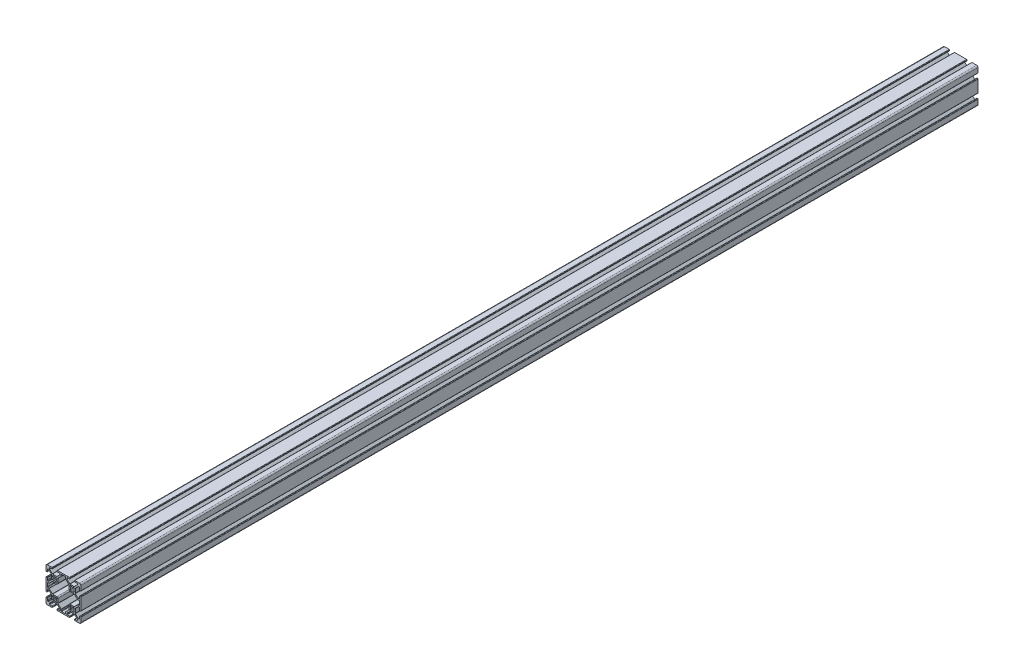
from build123d import *

# Parameters (mm, degrees)
EXTRUDE1_DEPTH = 1031.698


with BuildPart() as part:
    # Sketch1 → Extrude1 (new body)
    with BuildSketch(Plane.XY):
        with BuildLine():
            Line((-36.908207136, -152.779600216), (-32.140368459, -152.779600216))
            ThreePointArc((-32.140368459, -152.779600216), (-31.945965275, -152.818269413), (-31.781158214, -152.928389971))
            Line((-31.781158214, -152.928389971), (-28.678077553, -156.031470632))
            ThreePointArc((-28.678077553, -156.031470632), (-28.567956995, -156.196277694), (-28.529287798, -156.390680877))
            Line((-28.529287798, -156.390680877), (-28.529287798, -157.116600216))
            ThreePointArc((-28.529287798, -157.116600216), (-28.678077553, -157.475810461), (-29.037287798, -157.624600216))
            Line((-29.037287798, -157.624600216), (-31.386287798, -157.624600216))
            ThreePointArc((-31.386287798, -157.624600216), (-31.745498042, -157.773389971), (-31.894287798, -158.132600216))
            Line((-31.894287798, -158.132600216), (-31.894287798, -158.616600216))
            ThreePointArc((-31.894287798, -158.616600216), (-31.745498042, -158.975810461), (-31.386287798, -159.124600216))
            Line((-31.386287798, -159.124600216), (-17.662287798, -159.124600216))
            ThreePointArc((-17.662287798, -159.124600216), (-17.303077553, -158.975810461), (-17.154287798, -158.616600216))
            Line((-17.154287798, -158.616600216), (-17.154287798, -158.132600216))
            ThreePointArc((-17.154287798, -158.132600216), (-17.303077553, -157.773389971), (-17.662287798, -157.624600216))
            Line((-17.662287798, -157.624600216), (-20.011287798, -157.624600216))
            ThreePointArc((-20.011287798, -157.624600216), (-20.370498042, -157.475810461), (-20.519287798, -157.116600216))
            Line((-20.519287798, -157.116600216), (-20.519287798, -156.390680877))
            ThreePointArc((-20.519287798, -156.390680877), (-20.4806186, -156.196277694), (-20.370498042, -156.031470632))
            Line((-20.370498042, -156.031470632), (-17.267417381, -152.928389971))
            ThreePointArc((-17.267417381, -152.928389971), (-17.10261032, -152.818269413), (-16.908207136, -152.779600216))
            Line((-16.908207136, -152.779600216), (-12.140368459, -152.779600216))
            ThreePointArc((-12.140368459, -152.779600216), (-11.945965275, -152.818269413), (-11.781158214, -152.928389971))
            Line((-11.781158214, -152.928389971), (-8.678077553, -156.031470632))
            ThreePointArc((-8.678077553, -156.031470632), (-8.567956995, -156.196277694), (-8.529287798, -156.390680877))
            Line((-8.529287798, -156.390680877), (-8.529287798, -157.116600216))
            ThreePointArc((-8.529287798, -157.116600216), (-8.678077553, -157.475810461), (-9.037287798, -157.624600216))
            Line((-9.037287798, -157.624600216), (-11.386287798, -157.624600216))
            ThreePointArc((-11.386287798, -157.624600216), (-11.745498042, -157.773389971), (-11.894287798, -158.132600216))
            Line((-11.894287798, -158.132600216), (-11.894287798, -158.616600216))
            ThreePointArc((-11.894287798, -158.616600216), (-11.745498042, -158.975810461), (-11.386287798, -159.124600216))
            Line((-11.386287798, -159.124600216), (-6.024287798, -159.124600216))
            ThreePointArc((-6.024287798, -159.124600216), (-4.963627626, -158.685260388), (-4.524287798, -157.624600216))
            Line((-4.524287798, -157.624600216), (-4.524287798, -152.262600216))
            ThreePointArc((-4.524287798, -152.262600216), (-4.673077553, -151.903389971), (-5.032287798, -151.754600216))
            Line((-5.032287798, -151.754600216), (-5.516287798, -151.754600216))
            ThreePointArc((-5.516287798, -151.754600216), (-5.875498042, -151.903389971), (-6.024287798, -152.262600216))
            Line((-6.024287798, -152.262600216), (-6.024287798, -154.611600216))
            ThreePointArc((-6.024287798, -154.611600216), (-6.173077553, -154.970810461), (-6.532287798, -155.119600216))
            Line((-6.532287798, -155.119600216), (-7.258207136, -155.119600216))
            ThreePointArc((-7.258207136, -155.119600216), (-7.45261032, -155.080931018), (-7.617417381, -154.970810461))
            Line((-7.617417381, -154.970810461), (-10.720498042, -151.867729799))
            ThreePointArc((-10.720498042, -151.867729799), (-10.8306186, -151.702922738), (-10.869287798, -151.508519554))
            Line((-10.869287798, -151.508519554), (-10.869287798, -146.740680877))
            ThreePointArc((-10.869287798, -146.740680877), (-10.8306186, -146.546277694), (-10.720498042, -146.381470632))
            Line((-10.720498042, -146.381470632), (-7.617417381, -143.278389971))
            ThreePointArc((-7.617417381, -143.278389971), (-7.45261032, -143.168269413), (-7.258207136, -143.129600216))
            Line((-7.258207136, -143.129600216), (-6.532287798, -143.129600216))
            ThreePointArc((-6.532287798, -143.129600216), (-6.173077553, -143.278389971), (-6.024287798, -143.637600216))
            Line((-6.024287798, -143.637600216), (-6.024287798, -145.986600216))
            ThreePointArc((-6.024287798, -145.986600216), (-5.875498042, -146.345810461), (-5.516287798, -146.494600216))
            Line((-5.516287798, -146.494600216), (-5.032287798, -146.494600216))
            ThreePointArc((-5.032287798, -146.494600216), (-4.673077553, -146.345810461), (-4.524287798, -145.986600216))
            Line((-4.524287798, -145.986600216), (-4.524287798, -132.262600216))
            ThreePointArc((-4.524287798, -132.262600216), (-4.673077553, -131.903389971), (-5.032287798, -131.754600216))
            Line((-5.032287798, -131.754600216), (-5.516287798, -131.754600216))
            ThreePointArc((-5.516287798, -131.754600216), (-5.875498042, -131.903389971), (-6.024287798, -132.262600216))
            Line((-6.024287798, -132.262600216), (-6.024287798, -134.611600216))
            ThreePointArc((-6.024287798, -134.611600216), (-6.173077553, -134.970810461), (-6.532287798, -135.119600216))
            Line((-6.532287798, -135.119600216), (-7.258207136, -135.119600216))
            ThreePointArc((-7.258207136, -135.119600216), (-7.45261032, -135.080931018), (-7.617417381, -134.970810461))
            Line((-7.617417381, -134.970810461), (-10.720498042, -131.867729799))
            ThreePointArc((-10.720498042, -131.867729799), (-10.8306186, -131.702922738), (-10.869287798, -131.508519554))
            Line((-10.869287798, -131.508519554), (-10.869287798, -126.740680877))
            ThreePointArc((-10.869287798, -126.740680877), (-10.8306186, -126.546277694), (-10.720498042, -126.381470632))
            Line((-10.720498042, -126.381470632), (-7.617417381, -123.278389971))
            ThreePointArc((-7.617417381, -123.278389971), (-7.45261032, -123.168269413), (-7.258207136, -123.129600216))
            Line((-7.258207136, -123.129600216), (-6.532287798, -123.129600216))
            ThreePointArc((-6.532287798, -123.129600216), (-6.173077553, -123.278389971), (-6.024287798, -123.637600216))
            Line((-6.024287798, -123.637600216), (-6.024287798, -125.986600216))
            ThreePointArc((-6.024287798, -125.986600216), (-5.875498042, -126.345810461), (-5.516287798, -126.494600216))
            Line((-5.516287798, -126.494600216), (-5.032287798, -126.494600216))
            ThreePointArc((-5.032287798, -126.494600216), (-4.673077553, -126.345810461), (-4.524287798, -125.986600216))
            Line((-4.524287798, -125.986600216), (-4.524287798, -120.624600216))
            ThreePointArc((-4.524287798, -120.624600216), (-4.963627626, -119.563940044), (-6.024287798, -119.124600216))
            Line((-6.024287798, -119.124600216), (-11.386287798, -119.124600216))
            ThreePointArc((-11.386287798, -119.124600216), (-11.745498042, -119.273389971), (-11.894287798, -119.632600216))
            Line((-11.894287798, -119.632600216), (-11.894287798, -120.116600216))
            ThreePointArc((-11.894287798, -120.116600216), (-11.745498042, -120.475810461), (-11.386287798, -120.624600216))
            Line((-11.386287798, -120.624600216), (-9.037287798, -120.624600216))
            ThreePointArc((-9.037287798, -120.624600216), (-8.678077553, -120.773389971), (-8.529287798, -121.132600216))
            Line((-8.529287798, -121.132600216), (-8.529287798, -121.858519554))
            ThreePointArc((-8.529287798, -121.858519554), (-8.567956995, -122.052922738), (-8.678077553, -122.217729799))
            Line((-8.678077553, -122.217729799), (-11.781158214, -125.320810461))
            ThreePointArc((-11.781158214, -125.320810461), (-11.945965275, -125.430931018), (-12.140368459, -125.469600216))
            Line((-12.140368459, -125.469600216), (-16.908207136, -125.469600216))
            ThreePointArc((-16.908207136, -125.469600216), (-17.10261032, -125.430931018), (-17.267417381, -125.320810461))
            Line((-17.267417381, -125.320810461), (-20.370498042, -122.217729799))
            ThreePointArc((-20.370498042, -122.217729799), (-20.4806186, -122.052922738), (-20.519287798, -121.858519554))
            Line((-20.519287798, -121.858519554), (-20.519287798, -121.132600216))
            ThreePointArc((-20.519287798, -121.132600216), (-20.370498042, -120.773389971), (-20.011287798, -120.624600216))
            Line((-20.011287798, -120.624600216), (-17.662287798, -120.624600216))
            ThreePointArc((-17.662287798, -120.624600216), (-17.303077553, -120.475810461), (-17.154287798, -120.116600216))
            Line((-17.154287798, -120.116600216), (-17.154287798, -119.632600216))
            ThreePointArc((-17.154287798, -119.632600216), (-17.303077553, -119.273389971), (-17.662287798, -119.124600216))
            Line((-17.662287798, -119.124600216), (-31.386287798, -119.124600216))
            ThreePointArc((-31.386287798, -119.124600216), (-31.745498042, -119.273389971), (-31.894287798, -119.632600216))
            Line((-31.894287798, -119.632600216), (-31.894287798, -120.116600216))
            ThreePointArc((-31.894287798, -120.116600216), (-31.745498042, -120.475810461), (-31.386287798, -120.624600216))
            Line((-31.386287798, -120.624600216), (-29.037287798, -120.624600216))
            ThreePointArc((-29.037287798, -120.624600216), (-28.678077553, -120.773389971), (-28.529287798, -121.132600216))
            Line((-28.529287798, -121.132600216), (-28.529287798, -121.858519554))
            ThreePointArc((-28.529287798, -121.858519554), (-28.567956995, -122.052922738), (-28.678077553, -122.217729799))
            Line((-28.678077553, -122.217729799), (-31.781158214, -125.320810461))
            ThreePointArc((-31.781158214, -125.320810461), (-31.945965275, -125.430931018), (-32.140368459, -125.469600216))
            Line((-32.140368459, -125.469600216), (-36.908207136, -125.469600216))
            ThreePointArc((-36.908207136, -125.469600216), (-37.10261032, -125.430931018), (-37.267417381, -125.320810461))
            Line((-37.267417381, -125.320810461), (-40.370498042, -122.217729799))
            ThreePointArc((-40.370498042, -122.217729799), (-40.4806186, -122.052922738), (-40.519287798, -121.858519554))
            Line((-40.519287798, -121.858519554), (-40.519287798, -121.132600216))
            ThreePointArc((-40.519287798, -121.132600216), (-40.370498042, -120.773389971), (-40.011287798, -120.624600216))
            Line((-40.011287798, -120.624600216), (-37.662287798, -120.624600216))
            ThreePointArc((-37.662287798, -120.624600216), (-37.303077553, -120.475810461), (-37.154287798, -120.116600216))
            Line((-37.154287798, -120.116600216), (-37.154287798, -119.632600216))
            ThreePointArc((-37.154287798, -119.632600216), (-37.303077553, -119.273389971), (-37.662287798, -119.124600216))
            Line((-37.662287798, -119.124600216), (-43.024287798, -119.124600216))
            ThreePointArc((-43.024287798, -119.124600216), (-44.084947969, -119.563940044), (-44.524287798, -120.624600216))
            Line((-44.524287798, -120.624600216), (-44.524287798, -125.986600216))
            ThreePointArc((-44.524287798, -125.986600216), (-44.375498042, -126.345810461), (-44.016287798, -126.494600216))
            Line((-44.016287798, -126.494600216), (-43.532287798, -126.494600216))
            ThreePointArc((-43.532287798, -126.494600216), (-43.173077553, -126.345810461), (-43.024287798, -125.986600216))
            Line((-43.024287798, -125.986600216), (-43.024287798, -123.637600216))
            ThreePointArc((-43.024287798, -123.637600216), (-42.875498042, -123.278389971), (-42.516287798, -123.129600216))
            Line((-42.516287798, -123.129600216), (-41.790368459, -123.129600216))
            ThreePointArc((-41.790368459, -123.129600216), (-41.595965275, -123.168269413), (-41.431158214, -123.278389971))
            Line((-41.431158214, -123.278389971), (-38.328077553, -126.381470632))
            ThreePointArc((-38.328077553, -126.381470632), (-38.217956995, -126.546277694), (-38.179287798, -126.740680877))
            Line((-38.179287798, -126.740680877), (-38.179287798, -131.508519554))
            ThreePointArc((-38.179287798, -131.508519554), (-38.217956995, -131.702922738), (-38.328077553, -131.867729799))
            Line((-38.328077553, -131.867729799), (-41.431158214, -134.970810461))
            ThreePointArc((-41.431158214, -134.970810461), (-41.595965275, -135.080931018), (-41.790368459, -135.119600216))
            Line((-41.790368459, -135.119600216), (-42.516287798, -135.119600216))
            ThreePointArc((-42.516287798, -135.119600216), (-42.875498042, -134.970810461), (-43.024287798, -134.611600216))
            Line((-43.024287798, -134.611600216), (-43.024287798, -132.262600216))
            ThreePointArc((-43.024287798, -132.262600216), (-43.173077553, -131.903389971), (-43.532287798, -131.754600216))
            Line((-43.532287798, -131.754600216), (-44.016287798, -131.754600216))
            ThreePointArc((-44.016287798, -131.754600216), (-44.375498042, -131.903389971), (-44.524287798, -132.262600216))
            Line((-44.524287798, -132.262600216), (-44.524287798, -145.986600216))
            ThreePointArc((-44.524287798, -145.986600216), (-44.375498042, -146.345810461), (-44.016287798, -146.494600216))
            Line((-44.016287798, -146.494600216), (-43.532287798, -146.494600216))
            ThreePointArc((-43.532287798, -146.494600216), (-43.173077553, -146.345810461), (-43.024287798, -145.986600216))
            Line((-43.024287798, -145.986600216), (-43.024287798, -143.637600216))
            ThreePointArc((-43.024287798, -143.637600216), (-42.875498042, -143.278389971), (-42.516287798, -143.129600216))
            Line((-42.516287798, -143.129600216), (-41.790368459, -143.129600216))
            ThreePointArc((-41.790368459, -143.129600216), (-41.595965275, -143.168269413), (-41.431158214, -143.278389971))
            Line((-41.431158214, -143.278389971), (-38.328077553, -146.381470632))
            ThreePointArc((-38.328077553, -146.381470632), (-38.217956995, -146.546277694), (-38.179287798, -146.740680877))
            Line((-38.179287798, -146.740680877), (-38.179287798, -151.508519554))
            ThreePointArc((-38.179287798, -151.508519554), (-38.217956995, -151.702922738), (-38.328077553, -151.867729799))
            Line((-38.328077553, -151.867729799), (-41.431158214, -154.970810461))
            ThreePointArc((-41.431158214, -154.970810461), (-41.595965275, -155.080931018), (-41.790368459, -155.119600216))
            Line((-41.790368459, -155.119600216), (-42.516287798, -155.119600216))
            ThreePointArc((-42.516287798, -155.119600216), (-42.875498042, -154.970810461), (-43.024287798, -154.611600216))
            Line((-43.024287798, -154.611600216), (-43.024287798, -152.262600216))
            ThreePointArc((-43.024287798, -152.262600216), (-43.173077553, -151.903389971), (-43.532287798, -151.754600216))
            Line((-43.532287798, -151.754600216), (-44.016287798, -151.754600216))
            ThreePointArc((-44.016287798, -151.754600216), (-44.375498042, -151.903389971), (-44.524287798, -152.262600216))
            Line((-44.524287798, -152.262600216), (-44.524287798, -157.624600216))
            ThreePointArc((-44.524287798, -157.624600216), (-44.084947969, -158.685260388), (-43.024287798, -159.124600216))
            Line((-43.024287798, -159.124600216), (-37.662287798, -159.124600216))
            ThreePointArc((-37.662287798, -159.124600216), (-37.303077553, -158.975810461), (-37.154287798, -158.616600216))
            Line((-37.154287798, -158.616600216), (-37.154287798, -158.132600216))
            ThreePointArc((-37.154287798, -158.132600216), (-37.303077553, -157.773389971), (-37.662287798, -157.624600216))
            Line((-37.662287798, -157.624600216), (-40.011287798, -157.624600216))
            ThreePointArc((-40.011287798, -157.624600216), (-40.370498042, -157.475810461), (-40.519287798, -157.116600216))
            Line((-40.519287798, -157.116600216), (-40.519287798, -156.390680877))
            ThreePointArc((-40.519287798, -156.390680877), (-40.4806186, -156.196277694), (-40.370498042, -156.031470632))
            Line((-40.370498042, -156.031470632), (-37.267417381, -152.928389971))
            ThreePointArc((-37.267417381, -152.928389971), (-37.10261032, -152.818269413), (-36.908207136, -152.779600216))
        make_face()
        with BuildLine():
            Line((-16.649188641, -131.429106182), (-16.828793764, -131.249501059))
            ThreePointArc((-16.828793764, -131.249501059), (-17.030225814, -130.481068027), (-16.459421304, -129.928576934))
            ThreePointArc((-16.459421304, -129.928576934), (-16.619787798, -129.124600216), (-16.459421304, -128.320623498))
            ThreePointArc((-16.459421304, -128.320623498), (-17.030225814, -127.768132405), (-16.828793764, -126.999699372))
            Line((-16.828793764, -126.999699372), (-16.649188641, -126.82009425))
            ThreePointArc((-16.649188641, -126.82009425), (-15.880755608, -126.618662199), (-15.328264516, -127.18946671))
            ThreePointArc((-15.328264516, -127.18946671), (-14.524287798, -127.029100216), (-13.72031108, -127.18946671))
            ThreePointArc((-13.72031108, -127.18946671), (-13.167819987, -126.618662199), (-12.399386954, -126.82009425))
            Line((-12.399386954, -126.82009425), (-12.219781831, -126.999699372))
            ThreePointArc((-12.219781831, -126.999699372), (-12.018349781, -127.768132405), (-12.589154291, -128.320623498))
            ThreePointArc((-12.589154291, -128.320623498), (-12.428787798, -129.124600216), (-12.589154291, -129.928576934))
            ThreePointArc((-12.589154291, -129.928576934), (-12.018349781, -130.481068027), (-12.219781831, -131.249501059))
            Line((-12.219781831, -131.249501059), (-12.399386954, -131.429106182))
            ThreePointArc((-12.399386954, -131.429106182), (-13.167819987, -131.630538232), (-13.72031108, -131.059733722))
            ThreePointArc((-13.72031108, -131.059733722), (-14.524287798, -131.220100216), (-15.328264516, -131.059733722))
            ThreePointArc((-15.328264516, -131.059733722), (-15.880755608, -131.630538232), (-16.649188641, -131.429106182))
        make_face(mode=Mode.SUBTRACT)
        with BuildLine():
            Line((-36.649188641, -131.429106182), (-36.828793764, -131.249501059))
            ThreePointArc((-36.828793764, -131.249501059), (-37.030225814, -130.481068027), (-36.459421304, -129.928576934))
            ThreePointArc((-36.459421304, -129.928576934), (-36.619787798, -129.124600216), (-36.459421304, -128.320623498))
            ThreePointArc((-36.459421304, -128.320623498), (-37.030225814, -127.768132405), (-36.828793764, -126.999699372))
            Line((-36.828793764, -126.999699372), (-36.649188641, -126.82009425))
            ThreePointArc((-36.649188641, -126.82009425), (-35.880755608, -126.618662199), (-35.328264516, -127.18946671))
            ThreePointArc((-35.328264516, -127.18946671), (-34.524287798, -127.029100216), (-33.72031108, -127.18946671))
            ThreePointArc((-33.72031108, -127.18946671), (-33.167819987, -126.618662199), (-32.399386954, -126.82009425))
            Line((-32.399386954, -126.82009425), (-32.219781831, -126.999699372))
            ThreePointArc((-32.219781831, -126.999699372), (-32.018349781, -127.768132405), (-32.589154291, -128.320623498))
            ThreePointArc((-32.589154291, -128.320623498), (-32.428787798, -129.124600216), (-32.589154291, -129.928576934))
            ThreePointArc((-32.589154291, -129.928576934), (-32.018349781, -130.481068027), (-32.219781831, -131.249501059))
            Line((-32.219781831, -131.249501059), (-32.399386954, -131.429106182))
            ThreePointArc((-32.399386954, -131.429106182), (-33.167819987, -131.630538232), (-33.72031108, -131.059733722))
            ThreePointArc((-33.72031108, -131.059733722), (-34.524287798, -131.220100216), (-35.328264516, -131.059733722))
            ThreePointArc((-35.328264516, -131.059733722), (-35.880755608, -131.630538232), (-36.649188641, -131.429106182))
        make_face(mode=Mode.SUBTRACT)
        with BuildLine():
            Line((-16.649188641, -151.429106182), (-16.828793764, -151.249501059))
            ThreePointArc((-16.828793764, -151.249501059), (-17.030225814, -150.481068027), (-16.459421304, -149.928576934))
            ThreePointArc((-16.459421304, -149.928576934), (-16.619787798, -149.124600216), (-16.459421304, -148.320623498))
            ThreePointArc((-16.459421304, -148.320623498), (-17.030225814, -147.768132405), (-16.828793764, -146.999699372))
            Line((-16.828793764, -146.999699372), (-16.649188641, -146.82009425))
            ThreePointArc((-16.649188641, -146.82009425), (-15.880755608, -146.618662199), (-15.328264516, -147.18946671))
            ThreePointArc((-15.328264516, -147.18946671), (-14.524287798, -147.029100216), (-13.72031108, -147.18946671))
            ThreePointArc((-13.72031108, -147.18946671), (-13.167819987, -146.618662199), (-12.399386954, -146.82009425))
            Line((-12.399386954, -146.82009425), (-12.219781831, -146.999699372))
            ThreePointArc((-12.219781831, -146.999699372), (-12.018349781, -147.768132405), (-12.589154291, -148.320623498))
            ThreePointArc((-12.589154291, -148.320623498), (-12.428787798, -149.124600216), (-12.589154291, -149.928576934))
            ThreePointArc((-12.589154291, -149.928576934), (-12.018349781, -150.481068027), (-12.219781831, -151.249501059))
            Line((-12.219781831, -151.249501059), (-12.399386954, -151.429106182))
            ThreePointArc((-12.399386954, -151.429106182), (-13.167819987, -151.630538232), (-13.72031108, -151.059733722))
            ThreePointArc((-13.72031108, -151.059733722), (-14.524287798, -151.220100216), (-15.328264516, -151.059733722))
            ThreePointArc((-15.328264516, -151.059733722), (-15.880755608, -151.630538232), (-16.649188641, -151.429106182))
        make_face(mode=Mode.SUBTRACT)
        with BuildLine():
            Line((-27.029287798, -157.116600216), (-27.029287798, -155.769360534))
            ThreePointArc((-27.029287798, -155.769360534), (-27.067956995, -155.57495735), (-27.178077553, -155.410150289))
            Line((-27.178077553, -155.410150289), (-30.720498042, -151.867729799))
            ThreePointArc((-30.720498042, -151.867729799), (-30.8306186, -151.702922738), (-30.869287798, -151.508519554))
            Line((-30.869287798, -151.508519554), (-30.869287798, -146.612600216))
            ThreePointArc((-30.869287798, -146.612600216), (-31.204064747, -145.804377165), (-32.012287798, -145.469600216))
            Line((-32.012287798, -145.469600216), (-36.908207136, -145.469600216))
            ThreePointArc((-36.908207136, -145.469600216), (-37.10261032, -145.430931018), (-37.267417381, -145.320810461))
            Line((-37.267417381, -145.320810461), (-40.809837871, -141.778389971))
            ThreePointArc((-40.809837871, -141.778389971), (-40.974644932, -141.668269413), (-41.169048116, -141.629600216))
            Line((-41.169048116, -141.629600216), (-42.516287798, -141.629600216))
            ThreePointArc((-42.516287798, -141.629600216), (-42.875498042, -141.480810461), (-43.024287798, -141.121600216))
            Line((-43.024287798, -141.121600216), (-43.024287798, -137.127600216))
            ThreePointArc((-43.024287798, -137.127600216), (-42.875498042, -136.768389971), (-42.516287798, -136.619600216))
            Line((-42.516287798, -136.619600216), (-41.169048116, -136.619600216))
            ThreePointArc((-41.169048116, -136.619600216), (-40.974644932, -136.580931018), (-40.809837871, -136.470810461))
            Line((-40.809837871, -136.470810461), (-37.267417381, -132.928389971))
            ThreePointArc((-37.267417381, -132.928389971), (-37.10261032, -132.818269413), (-36.908207136, -132.779600216))
            Line((-36.908207136, -132.779600216), (-32.012287798, -132.779600216))
            ThreePointArc((-32.012287798, -132.779600216), (-31.204064747, -132.444823267), (-30.869287798, -131.636600216))
            Line((-30.869287798, -131.636600216), (-30.869287798, -126.740680877))
            ThreePointArc((-30.869287798, -126.740680877), (-30.8306186, -126.546277694), (-30.720498042, -126.381470632))
            Line((-30.720498042, -126.381470632), (-27.178077553, -122.839050143))
            ThreePointArc((-27.178077553, -122.839050143), (-27.067956995, -122.674243081), (-27.029287798, -122.479839898))
            Line((-27.029287798, -122.479839898), (-27.029287798, -121.132600216))
            ThreePointArc((-27.029287798, -121.132600216), (-26.880498042, -120.773389971), (-26.521287798, -120.624600216))
            Line((-26.521287798, -120.624600216), (-22.527287798, -120.624600216))
            ThreePointArc((-22.527287798, -120.624600216), (-22.168077553, -120.773389971), (-22.019287798, -121.132600216))
            Line((-22.019287798, -121.132600216), (-22.019287798, -122.479839898))
            ThreePointArc((-22.019287798, -122.479839898), (-21.9806186, -122.674243081), (-21.870498042, -122.839050143))
            Line((-21.870498042, -122.839050143), (-18.328077553, -126.381470632))
            ThreePointArc((-18.328077553, -126.381470632), (-18.217956995, -126.546277694), (-18.179287798, -126.740680877))
            Line((-18.179287798, -126.740680877), (-18.179287798, -131.636600216))
            ThreePointArc((-18.179287798, -131.636600216), (-17.844510848, -132.444823267), (-17.036287798, -132.779600216))
            Line((-17.036287798, -132.779600216), (-12.140368459, -132.779600216))
            ThreePointArc((-12.140368459, -132.779600216), (-11.945965275, -132.818269413), (-11.781158214, -132.928389971))
            Line((-11.781158214, -132.928389971), (-8.238737725, -136.470810461))
            ThreePointArc((-8.238737725, -136.470810461), (-8.073930663, -136.580931018), (-7.87952748, -136.619600216))
            Line((-7.87952748, -136.619600216), (-6.532287798, -136.619600216))
            ThreePointArc((-6.532287798, -136.619600216), (-6.173077553, -136.768389971), (-6.024287798, -137.127600216))
            Line((-6.024287798, -137.127600216), (-6.024287798, -141.121600216))
            ThreePointArc((-6.024287798, -141.121600216), (-6.173077553, -141.480810461), (-6.532287798, -141.629600216))
            Line((-6.532287798, -141.629600216), (-7.87952748, -141.629600216))
            ThreePointArc((-7.87952748, -141.629600216), (-8.073930663, -141.668269413), (-8.238737725, -141.778389971))
            Line((-8.238737725, -141.778389971), (-11.781158214, -145.320810461))
            ThreePointArc((-11.781158214, -145.320810461), (-11.945965275, -145.430931018), (-12.140368459, -145.469600216))
            Line((-12.140368459, -145.469600216), (-17.036287798, -145.469600216))
            ThreePointArc((-17.036287798, -145.469600216), (-17.844510848, -145.804377165), (-18.179287798, -146.612600216))
            Line((-18.179287798, -146.612600216), (-18.179287798, -151.508519554))
            ThreePointArc((-18.179287798, -151.508519554), (-18.217956995, -151.702922738), (-18.328077553, -151.867729799))
            Line((-18.328077553, -151.867729799), (-21.870498042, -155.410150289))
            ThreePointArc((-21.870498042, -155.410150289), (-21.9806186, -155.57495735), (-22.019287798, -155.769360534))
            Line((-22.019287798, -155.769360534), (-22.019287798, -157.116600216))
            ThreePointArc((-22.019287798, -157.116600216), (-22.168077553, -157.475810461), (-22.527287798, -157.624600216))
            Line((-22.527287798, -157.624600216), (-26.521287798, -157.624600216))
            ThreePointArc((-26.521287798, -157.624600216), (-26.880498042, -157.475810461), (-27.029287798, -157.116600216))
        make_face(mode=Mode.SUBTRACT)
        with BuildLine():
            Line((-36.649188641, -151.429106182), (-36.828793764, -151.249501059))
            ThreePointArc((-36.828793764, -151.249501059), (-37.030225814, -150.481068027), (-36.459421304, -149.928576934))
            ThreePointArc((-36.459421304, -149.928576934), (-36.619787798, -149.124600216), (-36.459421304, -148.320623498))
            ThreePointArc((-36.459421304, -148.320623498), (-37.030225814, -147.768132405), (-36.828793764, -146.999699372))
            Line((-36.828793764, -146.999699372), (-36.649188641, -146.82009425))
            ThreePointArc((-36.649188641, -146.82009425), (-35.880755608, -146.618662199), (-35.328264516, -147.18946671))
            ThreePointArc((-35.328264516, -147.18946671), (-34.524287798, -147.029100216), (-33.72031108, -147.18946671))
            ThreePointArc((-33.72031108, -147.18946671), (-33.167819987, -146.618662199), (-32.399386954, -146.82009425))
            Line((-32.399386954, -146.82009425), (-32.219781831, -146.999699372))
            ThreePointArc((-32.219781831, -146.999699372), (-32.018349781, -147.768132405), (-32.589154291, -148.320623498))
            ThreePointArc((-32.589154291, -148.320623498), (-32.428787798, -149.124600216), (-32.589154291, -149.928576934))
            ThreePointArc((-32.589154291, -149.928576934), (-32.018349781, -150.481068027), (-32.219781831, -151.249501059))
            Line((-32.219781831, -151.249501059), (-32.399386954, -151.429106182))
            ThreePointArc((-32.399386954, -151.429106182), (-33.167819987, -151.630538232), (-33.72031108, -151.059733722))
            ThreePointArc((-33.72031108, -151.059733722), (-34.524287798, -151.220100216), (-35.328264516, -151.059733722))
            ThreePointArc((-35.328264516, -151.059733722), (-35.880755608, -151.630538232), (-36.649188641, -151.429106182))
        make_face(mode=Mode.SUBTRACT)
    extrude(amount=EXTRUDE1_DEPTH)


solid = part.part
